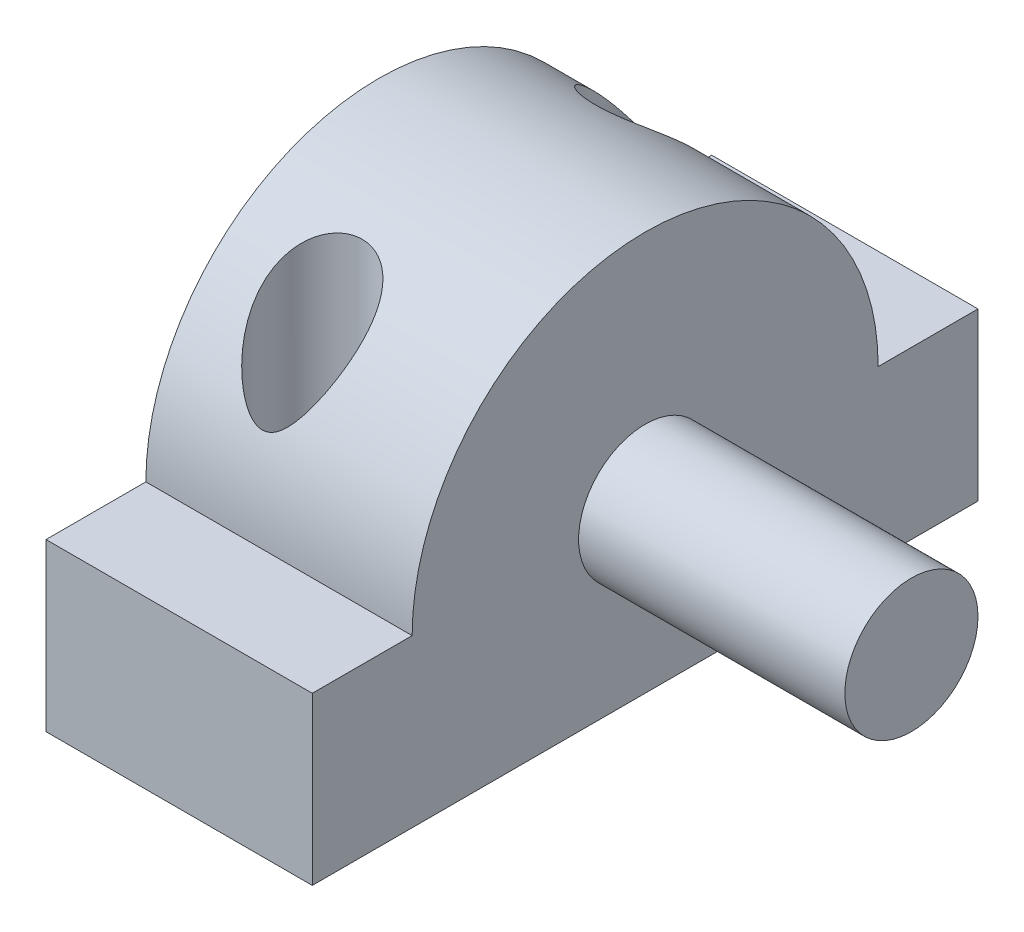
from build123d import *

# Parameters (mm, degrees)
BOSS_EXTRUDE1_DEPTH = 8
SKETCH2_R           = 2
BOSS_EXTRUDE2_DEPTH = 8
SKETCH3_R           = 1.5
CUT_EXTRUDE1_DEPTH  = 15


with BuildPart() as part:
    # Sketch1 → Boss-Extrude1 (new body)
    with BuildSketch(Plane(origin=(0, 0, 0), x_dir=(0, 0, -1), z_dir=(1, 0, 0))):
        with BuildLine():
            Line((17, 0), (20, 0))
            Line((20, 0), (20, -5))
            Line((20, -5), (0, -5))
            Line((0, -5), (0, 0))
            Line((0, 0), (3, 0))
            ThreePointArc((3, 0), (10, 7), (17, 0))
        make_face()
    extrude(amount=BOSS_EXTRUDE1_DEPTH)

    # Sketch2 → Boss-Extrude2 (add)
    with BuildSketch(Plane(origin=(8, 0, 0), x_dir=(0, 0, -1), z_dir=(1, 0, 0))):
        with Locations((10, 0)):
            Circle(SKETCH2_R)
    extrude(amount=BOSS_EXTRUDE2_DEPTH)

    # Sketch3 → Cut-Extrude1 (cut)
    with BuildSketch(Plane.XZ.offset(5)):
        with Locations(Location((3, -5, 0), (0, 0, 270))):
            Circle(SKETCH3_R)
        with Locations(Location((3, -15, 0), (0, 0, 270))):
            Circle(SKETCH3_R)
    extrude(amount=-CUT_EXTRUDE1_DEPTH, mode=Mode.SUBTRACT)


solid = part.part
